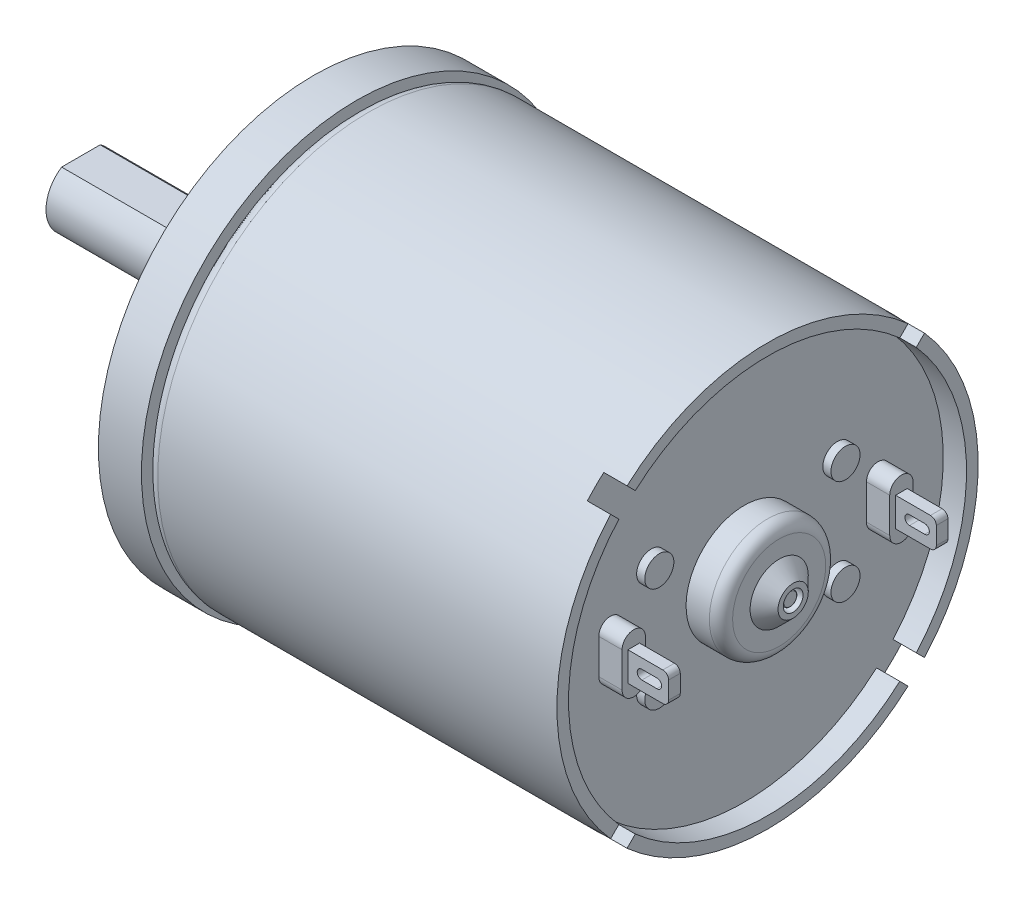
from build123d import *
from build123d.topology import SkipClean

# Parameters (mm, degrees)
SALIENTE_EXTRUIR1_START            = 2
SALIENTE_EXTRUIR1_DEPTH            = 2
SALIENTE_EXTRUIR2_DEPTH            = 0.5
CROQUIS3_5_R                       = 1.25
SALIENTE_EXTRUIR3_DEPTH            = 0.7
SALIENTE_EXTRUIR3_2_DEPTH          = 0.7
SALIENTE_EXTRUIR3_3_DEPTH          = 0.7
SALIENTE_EXTRUIR3_4_DEPTH          = 0.7
CORTAR_EXTRUIR1_START              = -14
CORTAR_EXTRUIR1_DEPTH              = 14
TALADRO_ROSCADO_M3X0_51_AT_2_COUNT = 2
TALADRO_ROSCADO_M3X0_51_AT_2_PITCH = 15.5
TALADRO_ROSCADO_M3X0_51_AT_3_COUNT = 2
TALADRO_ROSCADO_M3X0_51_AT_3_PITCH = 26.846787517
TALADRO_ROSCADO_M3X0_51_AT_4_COUNT = 2
TALADRO_ROSCADO_M3X0_51_AT_4_PITCH = 31
TALADRO_ROSCADO_M3X0_51_AT_5_COUNT = 2
TALADRO_ROSCADO_M3X0_51_AT_5_PITCH = 26.846787517
TALADRO_ROSCADO_M3X0_51_AT_6_COUNT = 2
TALADRO_ROSCADO_M3X0_51_AT_6_PITCH = 15.5
CORTAR_EXTRUIR2_DEPTH              = 0.2


with BuildPart() as part:
    # Croquis1 → Revolución1 (revolve)
    with BuildSketch(Plane.XY):
        with BuildLine():
            Line((-30.475, 0), (-30.475, 3))
            Line((-30.475, 3), (-15.475, 3))
            Line((-15.475, 3), (-15.475, 6))
            Line((-15.475, 6), (-10.475, 6))
            Line((-10.475, 6), (-10.475, 18.5))
            Line((-10.475, 18.5), (-6.775, 18.5))
            Line((-6.775, 18.5), (-6.775, 17.1))
            ThreePointArc((-6.775, 17.1), (-6.482106781, 17.807106781), (-5.775, 18.1))
            Line((-5.775, 18.1), (26.525, 18.1))
            Line((26.525, 18.1), (26.525, 5))
            Line((26.525, 5), (28.525, 5))
            ThreePointArc((28.525, 5), (29.232106781, 4.707106781), (29.525, 4))
            Line((29.525, 4), (29.525, 2.5))
            Line((29.525, 2.5), (30.725, 1.3))
            Line((30.725, 1.3), (30.725, 0.85))
            Line((30.725, 0.85), (29.225, 0.85))
            Line((29.225, 0.85), (29.225, 0.6))
            Line((29.225, 0.6), (30.425, 0.6))
            ThreePointArc((30.425, 0.6), (30.460355339, 0.585355339), (30.475, 0.55))
            Line((30.475, 0.55), (30.475, 0))
            Line((30.475, 0), (-30.475, 0))
        make_face()
    revolve(axis=Axis((-50, 0, 0), (1, 0, 0)))

    # Croquis3 → Saliente-Extruir1 (add)
    with SkipClean():  # the faces are left unmerged after this step: merging them gives an invalid solid
        with BuildSketch(Plane(origin=(26.525, 0, 0), x_dir=(0, 0, -1), z_dir=(1, 0, 0)).offset(SALIENTE_EXTRUIR1_START)):
            with BuildLine():
                Line((-13.486191255, 12.071977693), (-12.777939395, 11.363725833))
                ThreePointArc((-12.777939395, 11.363725833), (-17.1, 0), (-12.777939395, -11.363725833))
                Line((-12.777939395, -11.363725833), (-13.486191255, -12.071977693))
                ThreePointArc((-13.486191255, -12.071977693), (-18.1, 0), (-13.486191255, 12.071977693))
            make_face()
            with BuildLine():
                Line((12.071977693, 13.486191255), (11.363725833, 12.777939395))
                ThreePointArc((11.363725833, 12.777939395), (0, 17.1), (-11.363725833, 12.777939395))
                Line((-11.363725833, 12.777939395), (-12.071977693, 13.486191255))
                ThreePointArc((-12.071977693, 13.486191255), (0, 18.1), (12.071977693, 13.486191255))
            make_face()
            with BuildLine():
                Line((13.486191255, 12.071977693), (12.777939395, 11.363725833))
                ThreePointArc((12.777939395, 11.363725833), (17.1, 0), (12.777939395, -11.363725833))
                Line((12.777939395, -11.363725833), (13.486191255, -12.071977693))
                ThreePointArc((13.486191255, -12.071977693), (18.1, 0), (13.486191255, 12.071977693))
            make_face()
            with BuildLine():
                Line((11.363725833, -12.777939395), (12.071977693, -13.486191255))
                ThreePointArc((12.071977693, -13.486191255), (0, -18.1), (-12.071977693, -13.486191255))
                Line((-12.071977693, -13.486191255), (-11.363725833, -12.777939395))
                ThreePointArc((-11.363725833, -12.777939395), (0, -17.1), (11.363725833, -12.777939395))
            make_face()
            with BuildLine():
                Line((-10.5, 1.5), (-10.5, -1.5))
                ThreePointArc((-10.5, -1.5), (-11.5, -2.5), (-12.5, -1.5))
                Line((-12.5, -1.5), (-12.5, 1.5))
                ThreePointArc((-12.5, 1.5), (-11.5, 2.5), (-10.5, 1.5))
            make_face()
            with BuildLine():
                Line((10.5, 1.5), (10.5, -1.5))
                ThreePointArc((10.5, -1.5), (11.5, -2.5), (12.5, -1.5))
                Line((12.5, -1.5), (12.5, 1.5))
                ThreePointArc((12.5, 1.5), (11.5, 2.5), (10.5, 1.5))
            make_face()
        extrude(amount=-SALIENTE_EXTRUIR1_DEPTH)

    # Croquis5 → Saliente-Extruir2 (add, symmetric)
    with SkipClean():  # the faces are left unmerged after this step: merging them gives an invalid solid
        with BuildSketch(Plane.XY.offset(11.5)):
            with BuildLine():
                Line((28.525, 1.25), (31.525, 1.25))
                ThreePointArc((31.525, 1.25), (31.878553391, 1.103553391), (32.025, 0.75))
                Line((32.025, 0.75), (32.025, -0.75))
                ThreePointArc((32.025, -0.75), (31.878553391, -1.103553391), (31.525, -1.25))
                Line((31.525, -1.25), (28.525, -1.25))
                Line((28.525, -1.25), (28.525, 1.25))
            make_face()
            with BuildLine():
                Line((29.725, 0.4), (31.025, 0.4))
                ThreePointArc((31.025, 0.4), (31.425, 0), (31.025, -0.4))
                Line((31.025, -0.4), (29.725, -0.4))
                ThreePointArc((29.725, -0.4), (29.325, 0), (29.725, 0.4))
            make_face(mode=Mode.SUBTRACT)
        saliente_extruir2 = extrude(amount=SALIENTE_EXTRUIR2_DEPTH, both=True)

    # Simetría1: Saliente-Extruir2 across plane
    with SkipClean():  # the faces are left unmerged after this step: merging them gives an invalid solid
        add(saliente_extruir2.mirror(Plane.XY))

    # Croquis7 → Cortar-Extruir1 (cut)
    with SkipClean():  # the faces are left unmerged after this step: merging them gives an invalid solid
        with BuildSketch(Plane.ZY.offset(30.475).offset(CORTAR_EXTRUIR1_START)):
            with BuildLine():
                Line((-1.658312395, 2.5), (1.658312395, 2.5))
                ThreePointArc((1.658312395, 2.5), (0, 3), (-1.658312395, 2.5))
            make_face()
        extrude(amount=CORTAR_EXTRUIR1_DEPTH, mode=Mode.SUBTRACT)

    # Croquis10 → Taladro roscado M3x0.51 (revolve, cut)
    with SkipClean():  # the faces are left unmerged after this step: merging them gives an invalid solid
        with BuildSketch(Plane(origin=(-10.475, 15.5, 0), x_dir=(0, 0, 1), z_dir=(0, 1, 0))):
            Polygon((0, 0), (0, 5.751075774), (1.25, 5), (1.25, 0.316351312), (1.525, 0), align=None)
        taladro_roscado_m3x0_51 = revolve(axis=Axis((-16.825, 15.5, 0), (1, 0, 0)), mode=Mode.SUBTRACT)

    # Taladro roscado M3x0.51 at 2: Taladro roscado M3x0.51 ×2
    with SkipClean():  # the faces are left unmerged after this step: merging them gives an invalid solid
        with Locations(*[Vector(0, -0.49999999999995093, 0.866025403784467) * (i * TALADRO_ROSCADO_M3X0_51_AT_2_PITCH) for i in range(1, TALADRO_ROSCADO_M3X0_51_AT_2_COUNT)]):
            add(taladro_roscado_m3x0_51, mode=Mode.SUBTRACT)

    # Taladro roscado M3x0.51 at 3: Taladro roscado M3x0.51 ×2
    with SkipClean():  # the faces are left unmerged after this step: merging them gives an invalid solid
        with Locations(*[Vector(0, -0.8660254037844103, 0.5000000000000493) * (i * TALADRO_ROSCADO_M3X0_51_AT_3_PITCH) for i in range(1, TALADRO_ROSCADO_M3X0_51_AT_3_COUNT)]):
            add(taladro_roscado_m3x0_51, mode=Mode.SUBTRACT)

    # Taladro roscado M3x0.51 at 4: Taladro roscado M3x0.51 ×2
    with SkipClean():  # the faces are left unmerged after this step: merging them gives an invalid solid
        with Locations(*[(0, -i * TALADRO_ROSCADO_M3X0_51_AT_4_PITCH, 0) for i in range(1, TALADRO_ROSCADO_M3X0_51_AT_4_COUNT)]):
            add(taladro_roscado_m3x0_51, mode=Mode.SUBTRACT)

    # Taladro roscado M3x0.51 at 5: Taladro roscado M3x0.51 ×2
    with SkipClean():  # the faces are left unmerged after this step: merging them gives an invalid solid
        with Locations(*[Vector(0, -0.8660254037844671, -0.4999999999999508) * (i * TALADRO_ROSCADO_M3X0_51_AT_5_PITCH) for i in range(1, TALADRO_ROSCADO_M3X0_51_AT_5_COUNT)]):
            add(taladro_roscado_m3x0_51, mode=Mode.SUBTRACT)

    # Taladro roscado M3x0.51 at 6: Taladro roscado M3x0.51 ×2
    with SkipClean():  # the faces are left unmerged after this step: merging them gives an invalid solid
        with Locations(*[Vector(0, -0.500000000000049, -0.8660254037844104) * (i * TALADRO_ROSCADO_M3X0_51_AT_6_PITCH) for i in range(1, TALADRO_ROSCADO_M3X0_51_AT_6_COUNT)]):
            add(taladro_roscado_m3x0_51, mode=Mode.SUBTRACT)

    # Croquis11 → Cortar-Extruir2 (cut)
    with SkipClean():  # the faces are left unmerged after this step: merging them gives an invalid solid
        with BuildSketch(Plane.ZY.offset(10.475)):
            with BuildLine():
                Line((-10.674726274, 5.239295657), (-7.594268552, 3.460792562))
                ThreePointArc((-7.594268552, 3.460792562), (-7.161396057, 2.954973917), (-7.142001664, 2.289500434))
                ThreePointArc((-7.142001664, 2.289500434), (-7.5, 0), (-7.142001664, -2.289500434))
                ThreePointArc((-7.142001664, -2.289500434), (-7.161396057, -2.954973917), (-7.594268552, -3.460792562))
                Line((-7.594268552, -3.460792562), (-10.674726274, -5.239295657))
                ThreePointArc((-10.674726274, -5.239295657), (-11.50546243, -5.316993515), (-12.105953463, -4.737709441))
                ThreePointArc((-12.105953463, -4.737709441), (-13, 0), (-12.105953463, 4.737709441))
                ThreePointArc((-12.105953463, 4.737709441), (-11.50546243, 5.316993515), (-10.674726274, 5.239295657))
            make_face()
            with BuildLine():
                Line((-0.8, 11.86423196), (-0.8, 8.30722577))
                ThreePointArc((-0.8, 8.30722577), (-1.021615549, 7.679437871), (-1.588235294, 7.329905092))
                ThreePointArc((-1.588235294, 7.329905092), (-3.75, 6.495190528), (-5.55376637, 5.040404658))
                ThreePointArc((-5.55376637, 5.040404658), (-6.139780508, 4.724463954), (-6.794268552, 4.846433208))
                Line((-6.794268552, 4.846433208), (-9.874726274, 6.624936303))
                ThreePointArc((-9.874726274, 6.624936303), (-10.357382671, 7.305525989), (-10.155953463, 8.115208516))
                ThreePointArc((-10.155953463, 8.115208516), (-6.5, 11.258330249), (-1.95, 12.852917957))
                ThreePointArc((-1.95, 12.852917957), (-1.148079759, 12.622519504), (-0.8, 11.86423196))
            make_face()
            with BuildLine():
                Line((9.874726274, 6.624936303), (6.794268552, 4.846433208))
                ThreePointArc((6.794268552, 4.846433208), (6.139780508, 4.724463954), (5.55376637, 5.040404658))
                ThreePointArc((5.55376637, 5.040404658), (3.75, 6.495190528), (1.588235294, 7.329905092))
                ThreePointArc((1.588235294, 7.329905092), (1.021615549, 7.679437871), (0.8, 8.30722577))
                Line((0.8, 8.30722577), (0.8, 11.86423196))
                ThreePointArc((0.8, 11.86423196), (1.148079759, 12.622519504), (1.95, 12.852917957))
                ThreePointArc((1.95, 12.852917957), (6.5, 11.258330249), (10.155953463, 8.115208516))
                ThreePointArc((10.155953463, 8.115208516), (10.357382671, 7.305525989), (9.874726274, 6.624936303))
            make_face()
            with BuildLine():
                Line((10.674726274, 5.239295657), (7.594268552, 3.460792562))
                ThreePointArc((7.594268552, 3.460792562), (7.161396057, 2.954973917), (7.142001664, 2.289500434))
                ThreePointArc((7.142001664, 2.289500434), (7.5, 0), (7.142001664, -2.289500434))
                ThreePointArc((7.142001664, -2.289500434), (7.161396057, -2.954973917), (7.594268552, -3.460792562))
                Line((7.594268552, -3.460792562), (10.674726274, -5.239295657))
                ThreePointArc((10.674726274, -5.239295657), (11.50546243, -5.316993515), (12.105953463, -4.737709441))
                ThreePointArc((12.105953463, -4.737709441), (13, 0), (12.105953463, 4.737709441))
                ThreePointArc((12.105953463, 4.737709441), (11.50546243, 5.316993515), (10.674726274, 5.239295657))
            make_face()
            with BuildLine():
                Line((-0.8, -8.30722577), (-0.8, -11.86423196))
                ThreePointArc((-0.8, -11.86423196), (-1.148079759, -12.622519504), (-1.95, -12.852917957))
                ThreePointArc((-1.95, -12.852917957), (-6.5, -11.258330249), (-10.155953463, -8.115208516))
                ThreePointArc((-10.155953463, -8.115208516), (-10.357382671, -7.305525989), (-9.874726274, -6.624936303))
                Line((-9.874726274, -6.624936303), (-6.794268552, -4.846433208))
                ThreePointArc((-6.794268552, -4.846433208), (-6.139780508, -4.724463954), (-5.55376637, -5.040404658))
                ThreePointArc((-5.55376637, -5.040404658), (-3.75, -6.495190528), (-1.588235294, -7.329905092))
                ThreePointArc((-1.588235294, -7.329905092), (-1.021615549, -7.679437871), (-0.8, -8.30722577))
            make_face()
            with BuildLine():
                Line((0.8, -8.30722577), (0.8, -11.86423196))
                ThreePointArc((0.8, -11.86423196), (1.148079759, -12.622519504), (1.95, -12.852917957))
                ThreePointArc((1.95, -12.852917957), (6.5, -11.258330249), (10.155953463, -8.115208516))
                ThreePointArc((10.155953463, -8.115208516), (10.357382671, -7.305525989), (9.874726274, -6.624936303))
                Line((9.874726274, -6.624936303), (6.794268552, -4.846433208))
                ThreePointArc((6.794268552, -4.846433208), (6.139780508, -4.724463954), (5.55376637, -5.040404658))
                ThreePointArc((5.55376637, -5.040404658), (3.75, -6.495190528), (1.588235294, -7.329905092))
                ThreePointArc((1.588235294, -7.329905092), (1.021615549, -7.679437871), (0.8, -8.30722577))
            make_face()
        extrude(amount=-CORTAR_EXTRUIR2_DEPTH, mode=Mode.SUBTRACT)


with BuildPart() as body_2:
    # Croquis3<5> → Saliente-Extruir3 (new body)
    with BuildSketch(Plane(origin=(26.525, 0, 0), x_dir=(0, 0, -1), z_dir=(1, 0, 0))):
        with Locations((-8, 4.5)):
            Circle(CROQUIS3_5_R)
    extrude(amount=SALIENTE_EXTRUIR3_DEPTH)


with BuildPart() as body_3:
    # Croquis3<5> → Saliente-Extruir3 2 (new body)
    with BuildSketch(Plane(origin=(26.525, 0, 0), x_dir=(0, 0, -1), z_dir=(1, 0, 0))):
        with Locations((8, 4.5)):
            Circle(CROQUIS3_5_R)
    extrude(amount=SALIENTE_EXTRUIR3_2_DEPTH)


with BuildPart() as body_4:
    # Croquis3<5> → Saliente-Extruir3 3 (new body)
    with BuildSketch(Plane(origin=(26.525, 0, 0), x_dir=(0, 0, -1), z_dir=(1, 0, 0))):
        with Locations((8, -4.5)):
            Circle(CROQUIS3_5_R)
    extrude(amount=SALIENTE_EXTRUIR3_3_DEPTH)


with BuildPart() as body_5:
    # Croquis3<5> → Saliente-Extruir3 4 (new body)
    with BuildSketch(Plane(origin=(26.525, 0, 0), x_dir=(0, 0, -1), z_dir=(1, 0, 0))):
        with Locations((-8, -4.5)):
            Circle(CROQUIS3_5_R)
    extrude(amount=SALIENTE_EXTRUIR3_4_DEPTH)


solid = Compound([part.part, body_2.part, body_3.part, body_4.part, body_5.part])
